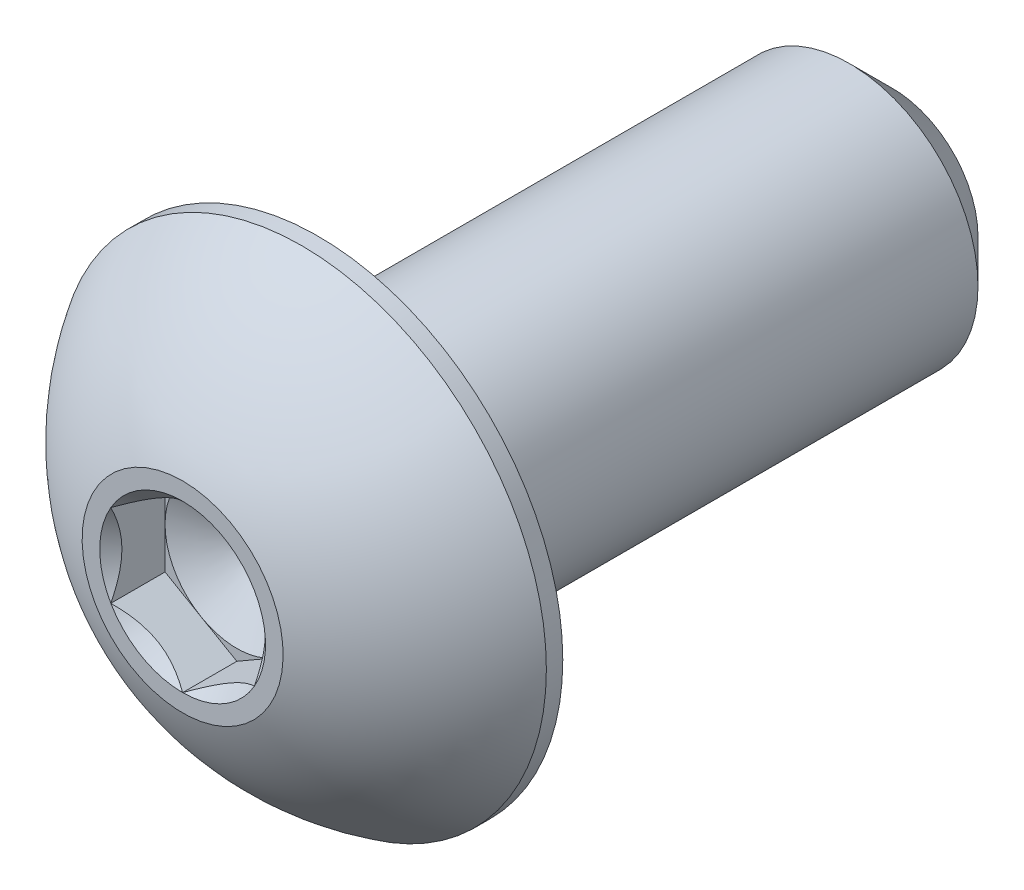
from build123d import *

# Parameters (mm, degrees)
CUT_EXTRUDE1_START = 3.32486
CUT_EXTRUDE1_DEPTH = 3.155583642


with BuildPart() as part:
    # Sketch2 → Revolve1 (revolve)
    with BuildSketch(Plane(origin=(0, 0, 0), x_dir=(0, 0, -1), z_dir=(1, 0, 0)), mode=Mode.PRIVATE) as revolve1_sk:
        with BuildLine():
            Line((-3.9243, 0.79375), (-3.9243, 1.11125))
            ThreePointArc((-3.9243, 1.11125), (-3.39937089, 2.018629974), (-2.607128571, 2.7051))
            Line((-2.607128571, 2.7051), (-2.4257, 2.7051))
            Line((-2.4257, 2.7051), (-2.4257, 1.4224))
            Line((-2.4257, 1.4224), (3.44805, 1.4224))
            Line((3.44805, 1.4224), (3.9243, 0.94615))
            Line((3.9243, 0.94615), (3.9243, 0))
            Line((3.9243, 0), (-2.866588224, 0))
            Line((-2.866588224, 0), (-3.32486, 0.79375))
            Line((-3.32486, 0.79375), (-3.9243, 0.79375))
        make_face()
    revolve(revolve1_sk.sketch.rotate(Axis((0, 0, 3.9243), (0, 0, -1)), 90), axis=Axis((0, 0, 3.9243), (0, 0, -1)))

    # Sketch3 → Cut-Extrude1 (cut, through all)
    with BuildSketch(Plane.XY.offset(CUT_EXTRUDE1_START)):
        Polygon((0, 0.916543552), (-0.79375, 0.458271776), (-0.79375, -0.458271776), (0, -0.916543552), (0.79375, -0.458271776), (0.79375, 0.458271776), align=None)
    extrude(amount=CUT_EXTRUDE1_DEPTH, mode=Mode.SUBTRACT)

    # Cut-Extrude2 cone 1 section (through the dimple's axis) → Cut-Extrude2 (revolve, cut)
    with BuildSketch(Plane(origin=(0, 0, 3.9243), x_dir=(0, -1, 0), z_dir=(1, 0, 0))):
        Polygon((0, 0), (0.916543552, 0), (0, 0.916543552), align=None)
    revolve(axis=Axis((0, 0, 3.9243), (0, 0, -1)), mode=Mode.SUBTRACT)


solid = part.part
